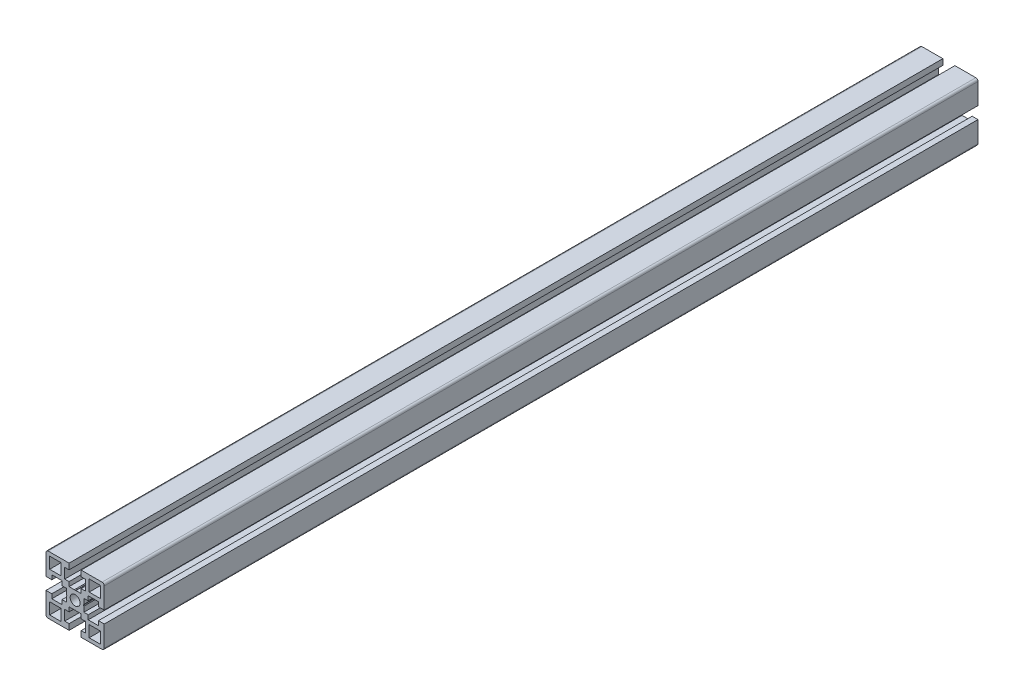
from build123d import *

# Parameters (mm, degrees)
SKETCH1_R           = 3.4
SKETCH1_W           = 7.85
SKETCH1_H           = 7.85
BOSS_EXTRUDE1_DEPTH = 600


with BuildPart() as part:
    # Sketch1 → Boss-Extrude1 (new body)
    with BuildSketch(Plane.XY):
        with BuildLine():
            Line((-7.15, 16), (-4.15, 16))
            Line((-4.15, 16), (-4.15, 20))
            Line((-4.15, 20), (-18.5, 20))
            ThreePointArc((-18.5, 20), (-19.560660172, 19.560660172), (-20, 18.5))
            Line((-20, 18.5), (-20, 4.15))
            Line((-20, 4.15), (-16, 4.15))
            Line((-16, 4.15), (-16, 7.15))
            Line((-16, 7.15), (-9, 7.15))
            Line((-9, 7.15), (-9, 4.15))
            Line((-9, 4.15), (-6, 4.15))
            Line((-6, 4.15), (-6, 0.519615242))
            Line((-6, 0.519615242), (-5.7, 0))
            Line((-5.7, 0), (-6, -0.519615242))
            Line((-6, -0.519615242), (-6, -4.15))
            Line((-6, -4.15), (-9, -4.15))
            Line((-9, -4.15), (-9, -7.15))
            Line((-9, -7.15), (-16, -7.15))
            Line((-16, -7.15), (-16, -4.15))
            Line((-16, -4.15), (-20, -4.15))
            Line((-20, -4.15), (-20, -18.5))
            ThreePointArc((-20, -18.5), (-19.560660172, -19.560660172), (-18.5, -20))
            Line((-18.5, -20), (-4.15, -20))
            Line((-4.15, -20), (-4.15, -16))
            Line((-4.15, -16), (-7.15, -16))
            Line((-7.15, -16), (-7.15, -9))
            Line((-7.15, -9), (-4.15, -9))
            Line((-4.15, -9), (-4.15, -6))
            Line((-4.15, -6), (-0.519615242, -6))
            Line((-0.519615242, -6), (0, -5.7))
            Line((0, -5.7), (0.519615242, -6))
            Line((0.519615242, -6), (4.15, -6))
            Line((4.15, -6), (4.15, -9))
            Line((4.15, -9), (7.15, -9))
            Line((7.15, -9), (7.15, -16))
            Line((7.15, -16), (4.15, -16))
            Line((4.15, -16), (4.15, -20))
            Line((4.15, -20), (18.5, -20))
            ThreePointArc((18.5, -20), (19.560660172, -19.560660172), (20, -18.5))
            Line((20, -18.5), (20, -4.15))
            Line((20, -4.15), (16, -4.15))
            Line((16, -4.15), (16, -7.15))
            Line((16, -7.15), (9, -7.15))
            Line((9, -7.15), (9, -4.15))
            Line((9, -4.15), (6, -4.15))
            Line((6, -4.15), (6, -0.519615242))
            Line((6, -0.519615242), (5.7, 0))
            Line((5.7, 0), (6, 0.519615242))
            Line((6, 0.519615242), (6, 4.15))
            Line((6, 4.15), (9, 4.15))
            Line((9, 4.15), (9, 7.15))
            Line((9, 7.15), (16, 7.15))
            Line((16, 7.15), (16, 4.15))
            Line((16, 4.15), (20, 4.15))
            Line((20, 4.15), (20, 18.5))
            ThreePointArc((20, 18.5), (19.560660172, 19.560660172), (18.5, 20))
            Line((18.5, 20), (4.15, 20))
            Line((4.15, 20), (4.15, 16))
            Line((4.15, 16), (7.15, 16))
            Line((7.15, 16), (7.15, 9))
            Line((7.15, 9), (4.15, 9))
            Line((4.15, 9), (4.15, 6))
            Line((4.15, 6), (0.519615242, 6))
            Line((0.519615242, 6), (0, 5.7))
            Line((0, 5.7), (-0.519615242, 6))
            Line((-0.519615242, 6), (-4.15, 6))
            Line((-4.15, 6), (-4.15, 9))
            Line((-4.15, 9), (-7.15, 9))
            Line((-7.15, 9), (-7.15, 16))
        make_face()
        with Locations(Location((0, 0, 0), (0, 0, 180))):
            Circle(SKETCH1_R, mode=Mode.SUBTRACT)
        with Locations((-13.575, 13.575)):
            Rectangle(SKETCH1_W, SKETCH1_H, mode=Mode.SUBTRACT)
        with Locations((13.575, 13.575)):
            Rectangle(SKETCH1_W, SKETCH1_H, mode=Mode.SUBTRACT)
        with Locations((-13.575, -13.575)):
            Rectangle(SKETCH1_W, SKETCH1_H, mode=Mode.SUBTRACT)
        with Locations((13.575, -13.575)):
            Rectangle(SKETCH1_W, SKETCH1_H, mode=Mode.SUBTRACT)
    extrude(amount=-BOSS_EXTRUDE1_DEPTH)


solid = part.part
